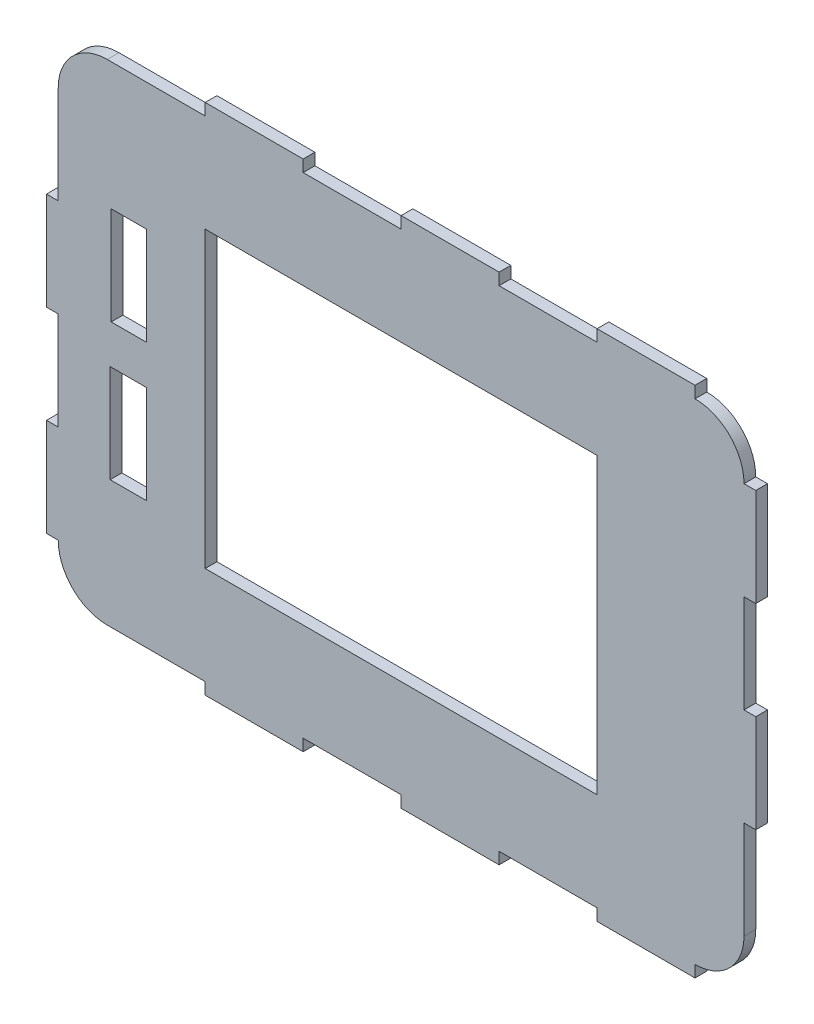
from build123d import *

# Parameters (mm, degrees)
ESQUISSE1_W        = 200
ESQUISSE1_H        = 150
ESQUISSE1_W_2      = 18
ESQUISSE1_H_2      = 50
ESQUISSE1_W_3      = 18.507782823
BOSS_EXTRU_1_DEPTH = 6


with BuildPart() as part:
    # Esquisse1 → Boss.-Extru.1 (new body)
    with BuildSketch(Plane.XY):
        with BuildLine():
            Line((0, 0), (0, 6))
            Line((0, 6), (50, 6))
            Line((50, 6), (50, 0))
            Line((50, 0), (100, 0))
            Line((100, 0), (100, 6))
            Line((100, 6), (150, 6))
            Line((150, 6), (150, 0))
            Line((150, 0), (200, 0))
            Line((200, 0), (200, 6))
            Line((200, 6), (250, 6))
            Line((250, 6), (250, 0))
            ThreePointArc((250, 0), (267.67766953, -7.32233047), (275, -25))
            Line((275, -25), (281, -25))
            Line((281, -25), (281, -75))
            Line((281, -75), (275, -75))
            Line((275, -75), (275, -125))
            Line((275, -125), (281, -125))
            Line((281, -125), (281, -175))
            Line((281, -175), (275, -175))
            Line((275, -175), (275, -225))
            ThreePointArc((275, -225), (267.67766953, -242.67766953), (250, -250))
            Line((250, -250), (250, -256))
            Line((250, -256), (200, -256))
            Line((200, -256), (200, -250))
            Line((200, -250), (150, -250))
            Line((150, -250), (150, -256))
            Line((150, -256), (100, -256))
            Line((100, -256), (100, -250))
            Line((100, -250), (50, -250))
            Line((50, -250), (50, -256))
            Line((50, -256), (0, -256))
            Line((0, -256), (0, -250))
            Line((0, -250), (-50, -250))
            ThreePointArc((-50, -250), (-67.67766953, -242.67766953), (-75, -225))
            Line((-75, -225), (-81, -225))
            Line((-81, -225), (-81, -175))
            Line((-81, -175), (-75, -175))
            Line((-75, -175), (-75, -125))
            Line((-75, -125), (-81, -125))
            Line((-81, -125), (-81, -75))
            Line((-81, -75), (-75, -75))
            Line((-75, -75), (-75, -25))
            ThreePointArc((-75, -25), (-67.67766953, -7.32233047), (-50, 0))
            Line((-50, 0), (0, 0))
        make_face()
        with Locations((100, -125)):
            Rectangle(ESQUISSE1_W, ESQUISSE1_H, mode=Mode.SUBTRACT)
        with Locations((-39, -90)):
            Rectangle(ESQUISSE1_W_2, ESQUISSE1_H_2, mode=Mode.SUBTRACT)
        with Locations((-39.253891412, -160)):
            Rectangle(ESQUISSE1_W_3, ESQUISSE1_H_2, mode=Mode.SUBTRACT)
    extrude(amount=BOSS_EXTRU_1_DEPTH)


solid = part.part
